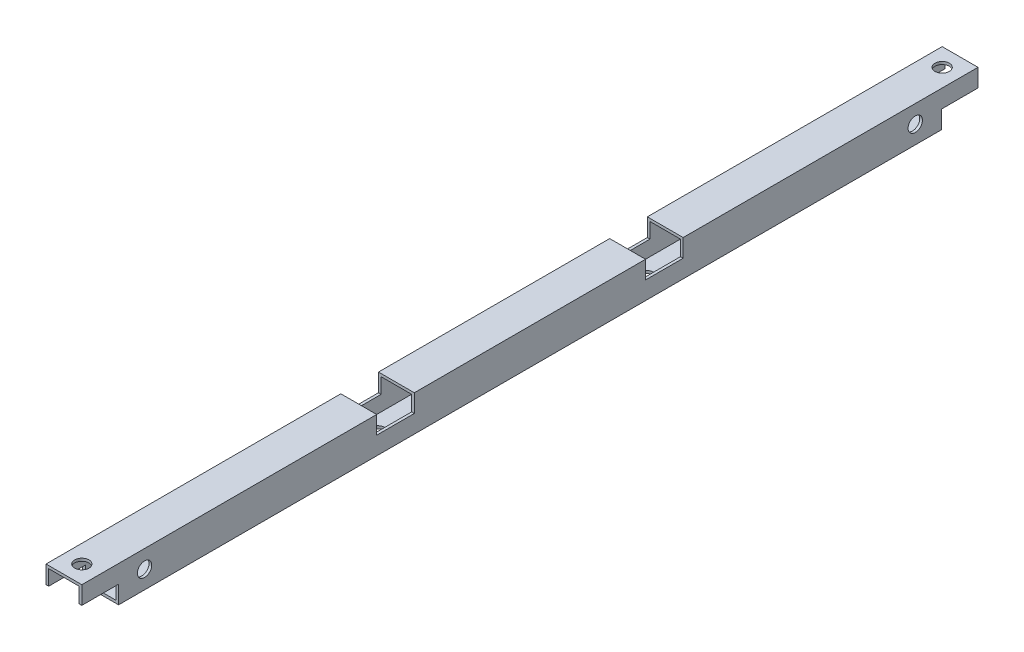
from build123d import *

# Parameters (mm, degrees)
SKETCH_1_W          = 20
SKETCH_1_H          = 20
EXTRUDE_1_DEPTH     = 500
SKETCH_2_W          = 20
SKETCH_2_H          = 10
CUT_EXTRUDE_1_DEPTH = 10.5
SKETCH_3_R          = 4
CUT_EXTRUDE_2_DEPTH = 21
SKETCH_4_W          = 20.5
SKETCH_4_H          = 10
CUT_EXTRUDE_5_DEPTH = 21
SKETCH_5_R          = 4
CUT_EXTRUDE_4_DEPTH = 21
SKETCH_6_R          = 4
CUT_EXTRUDE_6_DEPTH = 501.49975025
SKETCH_7_W          = 17
SKETCH_7_H          = 17
CUT_EXTRUDE_7_DEPTH = 501.199960016


with BuildPart() as part:
    # ｽｹｯﾁ1 → ﾎﾞｽ - 押し出し1 (new body)
    with BuildSketch(Plane.XY):
        Rectangle(SKETCH_1_W, SKETCH_1_H)
    extrude(amount=EXTRUDE_1_DEPTH)

    # ｽｹｯﾁ2 → ｶｯﾄ - 押し出し1 (cut, symmetric)
    with BuildSketch(Plane.XY.offset(325)):
        with Locations((0, 5)):
            Rectangle(SKETCH_2_W, SKETCH_2_H)
    cut_extrude_1 = extrude(amount=CUT_EXTRUDE_1_DEPTH, both=True, mode=Mode.SUBTRACT)

    # ﾐﾗｰ1: ｶｯﾄ - 押し出し1 across plane
    add(cut_extrude_1.mirror(Plane.XY.offset(250)), mode=Mode.SUBTRACT)

    # ｽｹｯﾁ3 → ｶｯﾄ - 押し出し2 (cut)
    with BuildSketch(Plane.XZ.offset(10)):
        with Locations(Location((0, 325, 0), (0, 0, 270))):
            Circle(SKETCH_3_R)
        with Locations(Location((0, 175, 0), (0, 0, 270))):
            Circle(SKETCH_3_R)
    extrude(amount=-CUT_EXTRUDE_2_DEPTH, mode=Mode.SUBTRACT)

    # ｽｹｯﾁ4 → ｶｯﾄ - 押し出し5 (cut)
    with BuildSketch(Plane(origin=(10, 0, 0), x_dir=(0, 0, -1), z_dir=(1, 0, 0))):
        with Locations((-10.25, -5)):
            Rectangle(SKETCH_4_W, SKETCH_4_H)
    cut_extrude_5 = extrude(amount=-CUT_EXTRUDE_5_DEPTH, mode=Mode.SUBTRACT)

    # ｽｹｯﾁ5 → ｶｯﾄ - 押し出し4 (cut)
    with BuildSketch(Plane.XZ.offset(10)):
        with Locations(Location((0, 10, 0), (0, 0, 270))):
            Circle(SKETCH_5_R)
        with Locations((0, 510.5)):
            Circle(SKETCH_5_R)
    cut_extrude_4 = extrude(amount=-CUT_EXTRUDE_4_DEPTH, mode=Mode.SUBTRACT)

    # ﾐﾗｰ3: ｶｯﾄ - 押し出し5 across plane
    add(cut_extrude_5.mirror(Plane.XY.offset(250)), mode=Mode.SUBTRACT)

    # ﾐﾗｰ4: ｶｯﾄ - 押し出し4 across plane
    add(cut_extrude_4.mirror(Plane.XY.offset(250)), mode=Mode.SUBTRACT)

    # ｽｹｯﾁ6 → ｶｯﾄ - 押し出し6 (cut, through all)
    with BuildSketch(Plane(origin=(10, 0, 0), x_dir=(0, 0, -1), z_dir=(1, 0, 0))):
        with Locations(Location((-35, 0, 0), (0, 0, 90))):
            Circle(SKETCH_6_R)
        with Locations(Location((-465, 0, 0), (0, 0, 90))):
            Circle(SKETCH_6_R)
    extrude(amount=-CUT_EXTRUDE_6_DEPTH, mode=Mode.SUBTRACT)

    # ｽｹｯﾁ7 → ｶｯﾄ - 押し出し7 (cut, through all)
    with BuildSketch(Plane(origin=(0, 0, 0), x_dir=(-1, 0, 0), z_dir=(0, 0, -1))):
        Rectangle(SKETCH_7_W, SKETCH_7_H)
    extrude(amount=-CUT_EXTRUDE_7_DEPTH, mode=Mode.SUBTRACT)


solid = part.part
